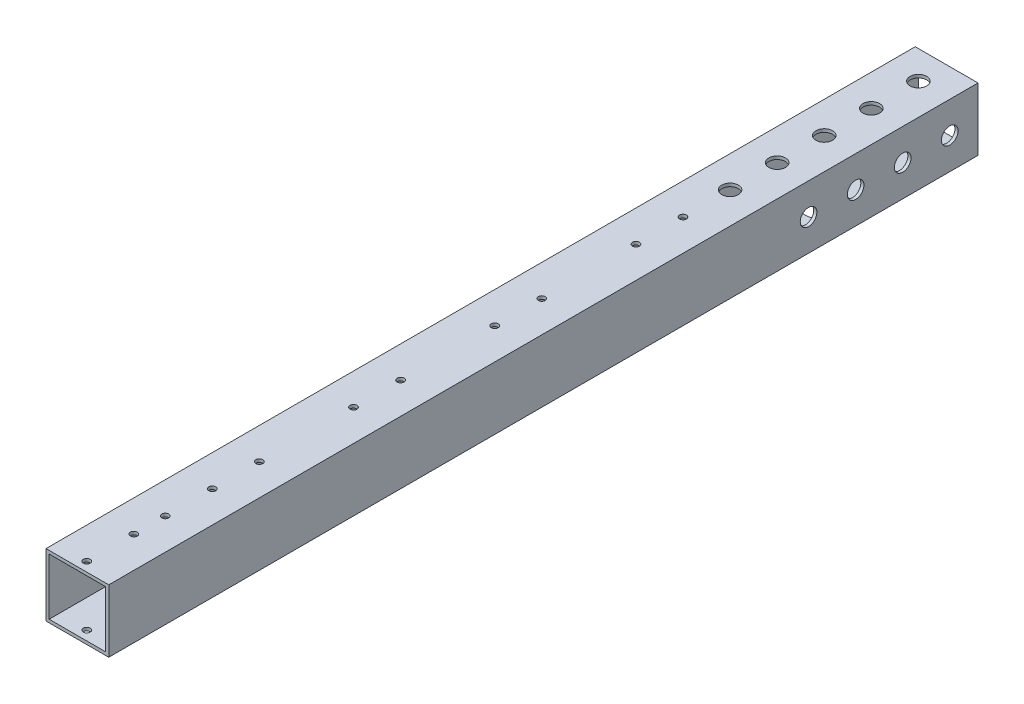
from build123d import *

# Parameters (mm, degrees)
SKETCH_1_W          = 20
SKETCH_1_H          = 20
SKETCH_1_W_2        = 18
SKETCH_1_H_2        = 18
EXTRUDE_2_DEPTH     = 277
SKETCH_2_R          = 2.65
SKETCH_2_R_2        = 1.1
CUT_EXTRUDE_1_DEPTH = 20
SKETCH_5_R          = 2.65
CUT_EXTRUDE_2_DEPTH = 20
SKETCH_6_R          = 6
CUT_EXTRUDE_3_DEPTH = 10


with BuildPart() as part:
    # 草图1 → 凸台-拉伸2 (new body)
    with BuildSketch(Plane.XY):
        with Locations((10, -10)):
            Rectangle(SKETCH_1_W, SKETCH_1_H)
        with Locations((10, -10)):
            Rectangle(SKETCH_1_W_2, SKETCH_1_H_2, mode=Mode.SUBTRACT)
    extrude(amount=EXTRUDE_2_DEPTH)

    # 草图2 → 切除-拉伸1 (cut)
    with BuildSketch(Plane(origin=(0, -20, 0), x_dir=(-1, 0, 0), z_dir=(0, -1, 0))):
        with Locations(Location((-10, -9, 0), (0, 0, 90))):
            Circle(SKETCH_2_R)
        with Locations(Location((-10, -24, 0), (0, 0, 90))):
            Circle(SKETCH_2_R)
        with Locations(Location((-10, -39, 0), (0, 0, 90))):
            Circle(SKETCH_2_R)
        with Locations(Location((-10, -54, 0), (0, 0, 90))):
            Circle(SKETCH_2_R)
        with Locations(Location((-10, -69, 0), (0, 0, 90))):
            Circle(SKETCH_2_R)
        with Locations(Location((-10, -99, 0), (0, 0, 90))):
            Circle(SKETCH_2_R_2)
        with Locations(Location((-10, -129, 0), (0, 0, 90))):
            Circle(SKETCH_2_R_2)
        with Locations(Location((-10, -144, 0), (0, 0, 90))):
            Circle(SKETCH_2_R_2)
        with Locations(Location((-10, -174, 0), (0, 0, 90))):
            Circle(SKETCH_2_R_2)
        with Locations(Location((-10, -189, 0), (0, 0, 90))):
            Circle(SKETCH_2_R_2)
        with Locations(Location((-10, -219, 0), (0, 0, 90))):
            Circle(SKETCH_2_R_2)
        with Locations(Location((-10, -234, 0), (0, 0, 90))):
            Circle(SKETCH_2_R_2)
        with Locations(Location((-10, -249, 0), (0, 0, 90))):
            Circle(SKETCH_2_R_2)
        with Locations(Location((-10, -84, 0), (0, 0, 90))):
            Circle(SKETCH_2_R_2)
        with Locations(Location((-10, -259, 0), (0, 0, 90))):
            Circle(SKETCH_2_R_2)
        with Locations(Location((-10, -274, 0), (0, 0, 90))):
            Circle(SKETCH_2_R_2)
    extrude(amount=-CUT_EXTRUDE_1_DEPTH, mode=Mode.SUBTRACT)

    # 草图5 → 切除-拉伸2 (cut)
    with BuildSketch(Plane.ZY):
        with Locations(Location((9, -10, 0), (0, 0, 270))):
            Circle(SKETCH_5_R)
        with Locations(Location((24, -10, 0), (0, 0, 270))):
            Circle(SKETCH_5_R)
        with Locations(Location((39, -10, 0), (0, 0, 270))):
            Circle(SKETCH_5_R)
        with Locations(Location((54, -10, 0), (0, 0, 270))):
            Circle(SKETCH_5_R)
    extrude(amount=-CUT_EXTRUDE_2_DEPTH, mode=Mode.SUBTRACT)

    # 草图6 → 切除-拉伸3 (cut)
    with BuildSketch(Plane(origin=(0, -20, 0), x_dir=(-1, 0, 0), z_dir=(0, -1, 0))):
        with Locations(Location((-10, -39, 0), (0, 0, 90))):
            Circle(SKETCH_6_R)
        with Locations(Location((-10, -54, 0), (0, 0, 90))):
            Circle(SKETCH_6_R)
        with Locations(Location((-10, -69, 0), (0, 0, 90))):
            Circle(SKETCH_6_R)
    extrude(amount=-CUT_EXTRUDE_3_DEPTH, mode=Mode.SUBTRACT)


solid = part.part
